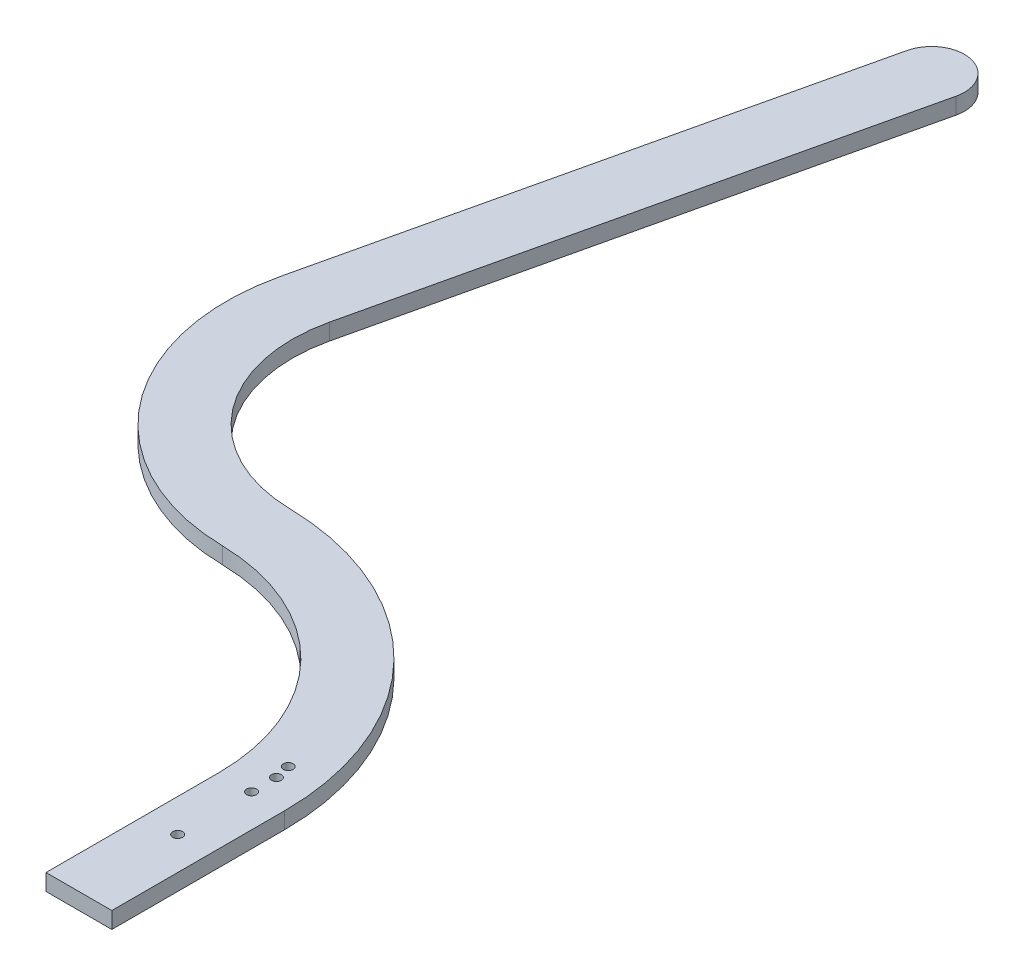
from build123d import *

# Parameters (mm, degrees)
SKETCH_1_R          = 1.5
EXTRUDE_1_DEPTH     = 5
SKETCH_2_R          = 1.5
CUT_EXTRUDE_2_DEPTH = 195.128306699


with BuildPart() as part:
    # 草圖1 → 伸長1 (new body)
    with BuildSketch(Plane(origin=(0, 0, 0), x_dir=(1, 0, 0), z_dir=(0, 1, 0))):
        with BuildLine():
            Line((57.897360436, -125.299605011), (57.897360436, -177.743637577))
            Line((57.897360436, -177.743637577), (77.897360436, -177.743637577))
            Line((77.897360436, -177.743637577), (77.897360436, -125.299605011))
            ThreePointArc((77.897360436, -125.299605011), (54.918314005, -69.05496851), (-0.871008877, -44.991569694))
            ThreePointArc((-0.871008877, -44.991569694), (-35.489867026, -27.667116556), (-43.844435656, 10.132396657))
            Line((-43.844435656, 10.132396657), (-8.109110739, 164.764632944))
            ThreePointArc((-8.109110739, 164.764632944), (-15.600674961, 176.759484569), (-27.595526586, 169.267920347))
            Line((-27.595526586, 169.267920347), (-63.330851503, 14.63568406))
            ThreePointArc((-63.330851503, 14.63568406), (-51.263141259, -39.963612803), (-1.258123933, -64.987822891))
            ThreePointArc((-1.258123933, -64.987822891), (40.639968493, -83.059569519), (57.897360436, -125.299605011))
        make_face()
        with Locations(Location((66.82899479, -113.088129791, 0), (0, 0, 270))):
            Circle(SKETCH_1_R, mode=Mode.SUBTRACT)
        with Locations(Location((67.897360436, -125.299605011, 0), (0, 0, 270))):
            Circle(SKETCH_1_R, mode=Mode.SUBTRACT)
    extrude(amount=EXTRUDE_1_DEPTH)

    # 草圖2 → 伸長2 (cut, through all)
    with BuildSketch(Plane(origin=(0, 5, 0), x_dir=(1, 0, 0), z_dir=(0, 1, 0))):
        with Locations(Location((67.897360436, -117.743637577, 0), (0, 0, 270))):
            Circle(SKETCH_2_R)
        with Locations(Location((67.897360436, -147.743637577, 0), (0, 0, 270))):
            Circle(SKETCH_2_R)
    extrude(amount=-CUT_EXTRUDE_2_DEPTH, mode=Mode.SUBTRACT)


solid = part.part
